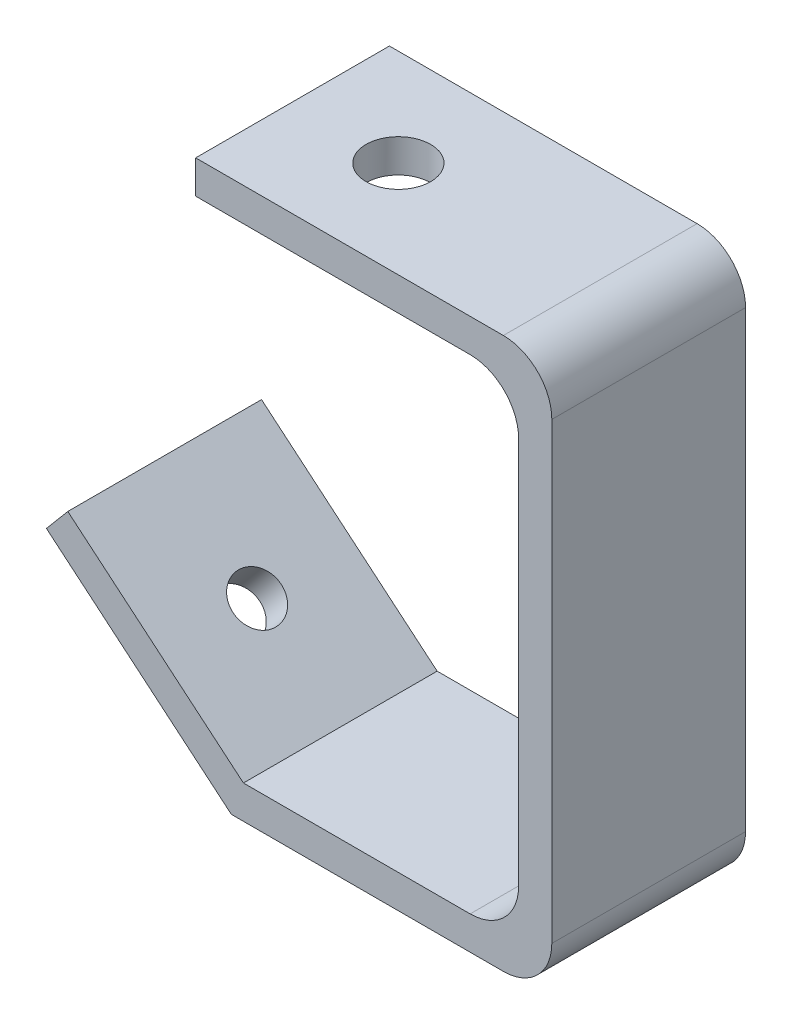
from build123d import *

# Parameters (mm, degrees)
BOSS_EXTRUDE1_DEPTH = 38.1
SKETCH2_R           = 6.35
CUT_EXTRUDE1_DEPTH  = 86.1
SKETCH4_R           = 4.765
CUT_EXTRUDE2_DEPTH  = 9.1


with BuildPart() as part:
    # Sketch1 → Boss-Extrude1 (new body)
    with BuildSketch(Plane.XY):
        with BuildLine():
            Line((0, 0), (44.591, 0))
            ThreePointArc((44.591, 0), (51.329727625, 2.791272375), (54.121, 9.53))
            Line((54.121, 9.53), (54.121, 85.72))
            ThreePointArc((54.121, 85.72), (51.329727625, 92.458727625), (44.591, 95.25))
            Line((44.591, 95.25), (-9.389, 95.25))
            Line((-9.389, 95.25), (-9.389, 101.78))
            Line((-9.389, 101.78), (51.121, 101.78))
            ThreePointArc((51.121, 101.78), (57.859727625, 98.988727625), (60.651, 92.25))
            Line((60.651, 92.25), (60.651, 3))
            ThreePointArc((60.651, 3), (57.859727625, -3.738727625), (51.121, -6.53))
            Line((51.121, -6.53), (-2.37672563, -6.53))
            Line((-2.37672563, -6.53), (-38.738347031, 23.981023107))
            Line((-38.738347031, 23.981023107), (-34.54094394, 28.983293321))
            Line((-34.54094394, 28.983293321), (0, 0))
        make_face()
    extrude(amount=BOSS_EXTRUDE1_DEPTH)

    # Sketch2 → Cut-Extrude1 (cut)
    with BuildSketch(Plane(origin=(0, 101.78, 0), x_dir=(1, 0, 0), z_dir=(0, 1, 0))):
        with Locations(Location((11.421, -19.05, 0), (0, 0, 270))):
            Circle(SKETCH2_R)
    extrude(amount=-CUT_EXTRUDE1_DEPTH, mode=Mode.SUBTRACT)

    # Sketch4 → Cut-Extrude2 (cut)
    with BuildSketch(Plane(origin=(-4.197403091, -5.002270214, 0), x_dir=(0.7660444431189817, -0.642787609686535, 0), z_dir=(-0.642787609686535, -0.7660444431189818, 0))):
        with Locations((-21.356637185, 19.05)):
            Circle(SKETCH4_R)
    extrude(amount=-CUT_EXTRUDE2_DEPTH, mode=Mode.SUBTRACT)


solid = part.part
